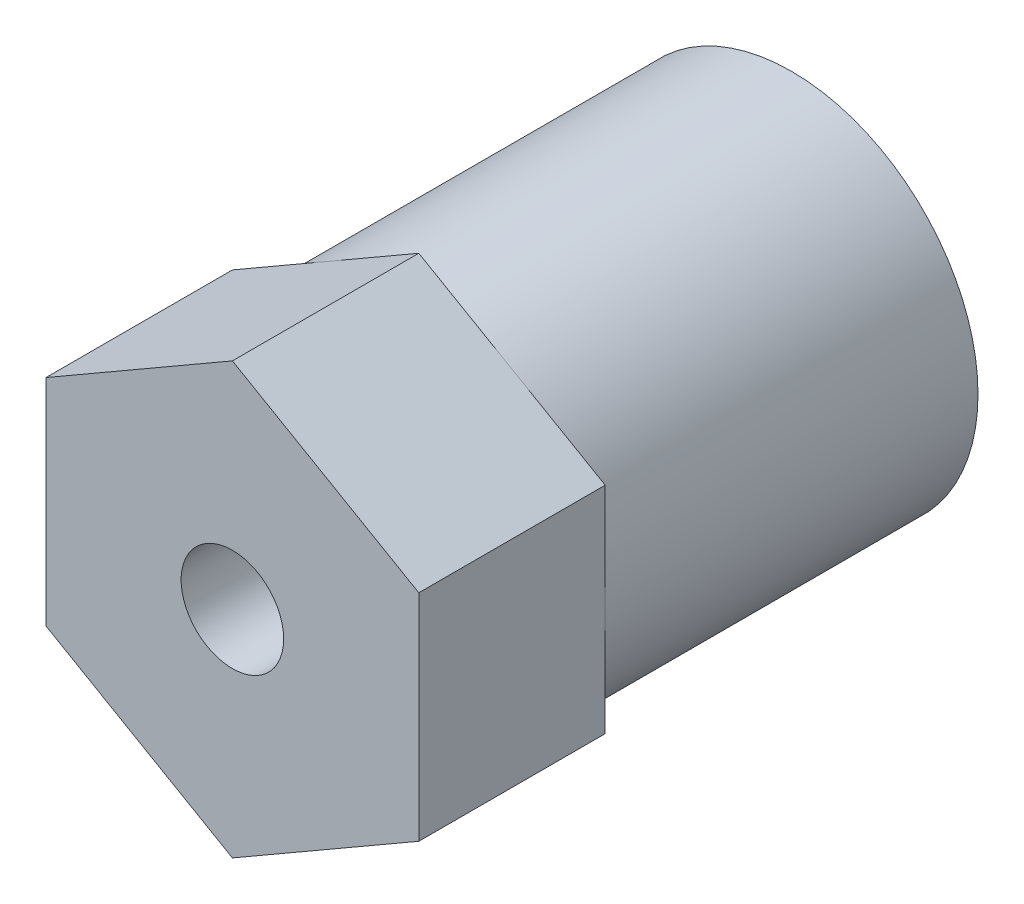
from build123d import *

# Parameters (mm, degrees)
SHAFT_SOCKET_START = -12
PROFILE_1_R        = 6
PROFILE_1_R_2      = 4
SHAFT_SOCKET_DEPTH = 12
PROFILE_2_R        = 1.65
DRIVE_HEX_DEPTH    = 6


with BuildPart() as part:
    # Profile_1 → Shaft_socket (new body)
    with BuildSketch(Plane.XY.offset(SHAFT_SOCKET_START)):
        Circle(PROFILE_1_R)
        Circle(PROFILE_1_R_2, mode=Mode.SUBTRACT)
    extrude(amount=SHAFT_SOCKET_DEPTH)

    # Profile_2 → Drive_hex (add)
    with BuildSketch(Plane.XY):
        Polygon((6, 3.464101615), (0, 6.92820323), (-6, 3.464101615), (-6, -3.464101615), (0, -6.92820323), (6, -3.464101615), align=None)
        Circle(PROFILE_2_R, mode=Mode.SUBTRACT)
    extrude(amount=DRIVE_HEX_DEPTH)


solid = part.part
